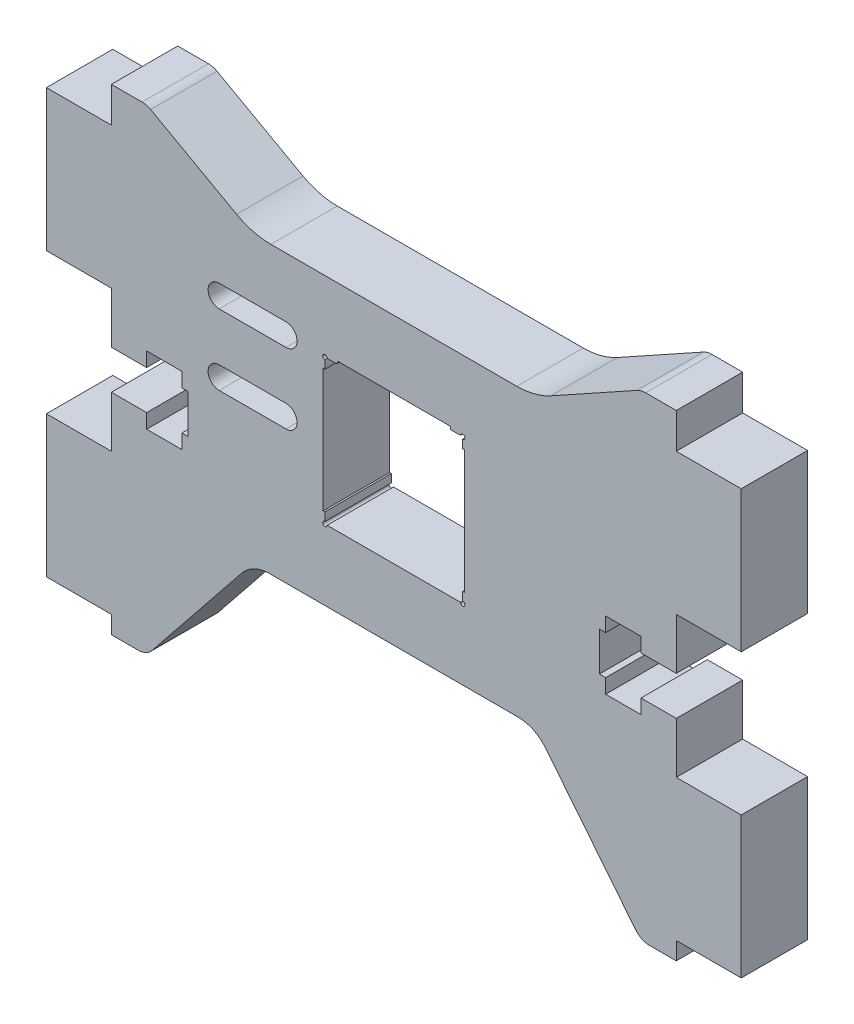
from build123d import *

# Parameters (mm, degrees)
SKETCH1_W           = 12.3904
SKETCH1_H           = 13
BOSS_EXTRUDE1_DEPTH = 5.969
CUT_EXTRUDE1_DEPTH  = 41.286380146
SKETCH3_R           = 0.1984375
CUT_EXTRUDE2_DEPTH  = 41.286380146
FILLET1_R           = 3.175
FILLET2_R           = 1.5875
SKETCH4_W           = 12.7
SKETCH4_H           = 11.1125
CUT_EXTRUDE3_DEPTH  = 41.286380146
SKETCH5_W           = 10.16
SKETCH5_H           = 0.5
CUT_EXTRUDE4_DEPTH  = 41.286380146
FILLET8_R           = 0.1
CUT_EXTRUDE5_DEPTH  = 41.286380146
FILLET9_R           = 6.35


with BuildPart() as part:
    # Sketch1 → Boss-Extrude1 (new body)
    with BuildSketch(Plane.XY):
        Polygon((25.4, 2.263), (25.4, -10.437), (31.242, -10.437), (31.242, -23.137), (25.4, -23.137), (25.4, -24.7245), (22.225, -24.7245), (12.7, -12.85), (-12.7, -12.85), (-22.225, -24.7245), (-25.4, -24.7245), (-25.4, -23.137), (-31.242, -23.137), (-31.242, -10.437), (-25.4, -10.437), (-25.4, 2.263), (-31.242, 2.263), (-31.242, 14.963), (-25.4, 14.963), (-25.4, 18.138), (-22.225, 18.138), (-12.7, 12.85), (12.7, 12.85), (22.225, 18.138), (25.4, 18.138), (25.4, 14.963), (31.242, 14.963), (31.242, 2.263), align=None)
        Rectangle(SKETCH1_W, SKETCH1_H, mode=Mode.SUBTRACT)
    extrude(amount=BOSS_EXTRUDE1_DEPTH)

    # Sketch2 → Cut-Extrude1 (cut, through all)
    with BuildSketch(Plane.XY.offset(5.969)):
        Polygon((22.225, -2.3344), (22.225, -1.039), (19.05, -1.039), (19.05, -2.3344), (18.492, -2.3344), (18.492, -5.8396), (19.05, -5.8396), (19.05, -7.135), (22.225, -7.135), (22.225, -5.8396), (25.4, -5.8396), (25.4, -2.3344), align=None)
        Polygon((-19.05, -2.3344), (-19.05, -1.039), (-22.225, -1.039), (-22.225, -2.3344), (-25.4, -2.3344), (-25.4, -5.8396), (-22.225, -5.8396), (-22.225, -7.135), (-19.05, -7.135), (-19.05, -5.8396), (-18.492, -5.8396), (-18.492, -2.3344), align=None)
    extrude(amount=-CUT_EXTRUDE1_DEPTH, mode=Mode.SUBTRACT)

    # Sketch3 → Cut-Extrude2 (cut, through all)
    with BuildSketch(Plane.XY.offset(5.969)):
        with Locations((6.1952, 6.5)):
            Circle(SKETCH3_R)
        with Locations((-6.1952, 6.5)):
            Circle(SKETCH3_R)
        with Locations((-6.1952, -6.5)):
            Circle(SKETCH3_R)
        with Locations((6.1952, -6.5)):
            Circle(SKETCH3_R)
    extrude(amount=-CUT_EXTRUDE2_DEPTH, mode=Mode.SUBTRACT)

    # Fillet1
    fillet1_edges = [part.edges().sort_by_distance(p)[0] for p in [
        (12.7, -12.85, 2.9845),
        (-12.7, -12.85, 2.9845),
    ]]
    fillet(fillet1_edges, radius=FILLET1_R)

    # Fillet2
    fillet2_edges = [part.edges().sort_by_distance(p)[0] for p in [
        (22.225, -24.7245, 2.9845),
        (-22.225, -24.7245, 2.9845),
        (-22.225, 18.138, 2.9845),
        (22.225, 18.138, 2.9845),
    ]]
    fillet(fillet2_edges, radius=FILLET2_R)

    # Sketch4 → Cut-Extrude3 (cut, through all)
    with BuildSketch(Plane.XY.offset(5.969)):
        Rectangle(SKETCH4_W, SKETCH4_H)
    extrude(amount=-CUT_EXTRUDE3_DEPTH, mode=Mode.SUBTRACT)

    # Sketch5 → Cut-Extrude4 (cut, through all)
    with BuildSketch(Plane.XY.offset(5.969)):
        with Locations((0, 6.5)):
            Rectangle(SKETCH5_W, SKETCH5_H)
    extrude(amount=-CUT_EXTRUDE4_DEPTH, mode=Mode.SUBTRACT)

    # Fillet8
    fillet8_edges = [part.edges().sort_by_distance(p)[0] for p in [
        (5.08, 6.5, 2.9845),
        (-5.08, 6.5, 2.9845),
        (-5.08, 6.75, 2.9845),
        (5.08, 6.75, 2.9845),
    ]]
    fillet(fillet8_edges, radius=FILLET8_R)

    # Sketch6 → Cut-Extrude5 (cut, through all)
    with BuildSketch(Plane.XY.offset(5.969)):
        with BuildLine():
            Line((-15.7, 7.5), (-9.7, 7.5))
            ThreePointArc((-9.7, 7.5), (-8.7, 6.5), (-9.7, 5.5))
            Line((-9.7, 5.5), (-15.7, 5.5))
            ThreePointArc((-15.7, 5.5), (-16.7, 6.5), (-15.7, 7.5))
        make_face()
        with BuildLine():
            Line((-15.7, 1.15), (-9.7, 1.15))
            ThreePointArc((-9.7, 1.15), (-8.7, 0.15), (-9.7, -0.85))
            Line((-9.7, -0.85), (-15.7, -0.85))
            ThreePointArc((-15.7, -0.85), (-16.7, 0.15), (-15.7, 1.15))
        make_face()
    extrude(amount=-CUT_EXTRUDE5_DEPTH, mode=Mode.SUBTRACT)

    # Fillet9
    fillet9_edges = [part.edges().sort_by_distance(p)[0] for p in [
        (-12.7, 12.85, 2.9845),
        (12.7, 12.85, 2.9845),
    ]]
    fillet(fillet9_edges, radius=FILLET9_R)


solid = part.part
